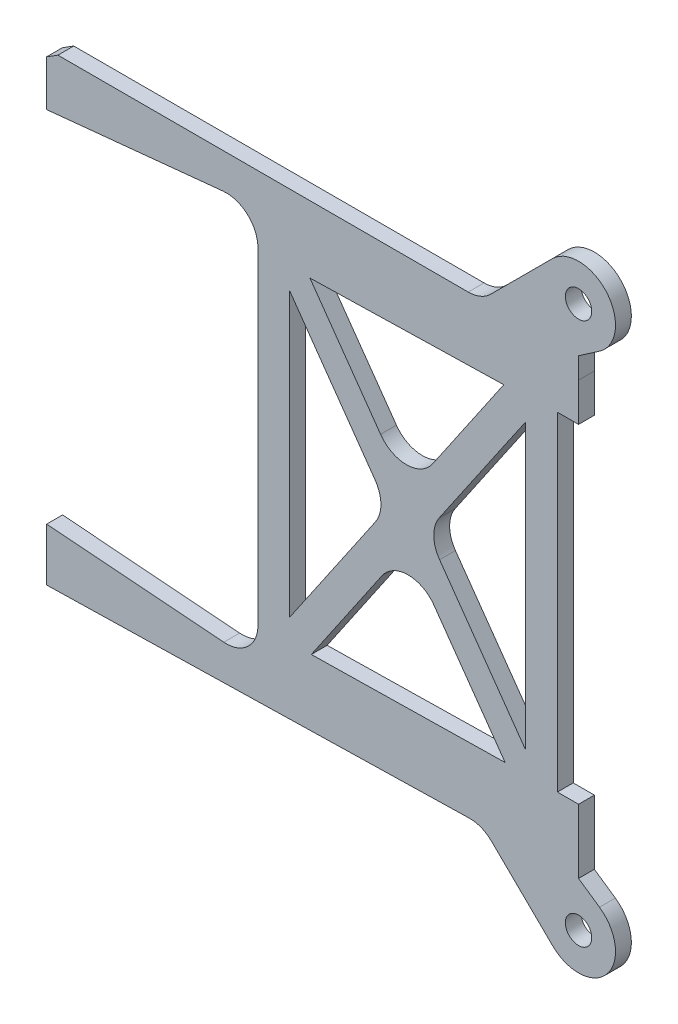
from build123d import *

# Parameters (mm, degrees)
MODEL_R         = 1.25
EXTRUDE_1_DEPTH = 1.5


with BuildPart() as part:
    # Model → 凸台-拉伸1 (new body)
    with BuildSketch(Plane.XY):
        with BuildLine():
            Line((580.995568625, 495.770292788), (600.902512418, 495.770292788))
            ThreePointArc((600.902512418, 495.770292788), (602.050562715, 495.99865419), (603.023832761, 496.648972444))
            Line((603.023832761, 496.648972444), (608.87002472, 502.495166354))
            ThreePointArc((608.87002472, 502.495166354), (614.034668548, 502.25974311), (613.330350777, 497.137936158))
            Line((613.330350777, 497.137936158), (611.344894179, 495.770295165))
            Line((611.344894179, 495.770295165), (611.344903066, 493.770295165))
            Line((611.344903066, 493.770295165), (611.344898622, 490.139940091))
            Line((611.344898622, 490.139940091), (609.344898622, 490.139940091))
            Line((609.344898622, 490.139940091), (609.344898622, 459.003527023))
            Line((609.344898622, 459.003527023), (611.344898622, 459.003527023))
            Line((611.344898622, 459.003527023), (611.344903066, 454.922529401))
            Line((611.344903066, 454.922529401), (611.344903066, 452.922529401))
            Line((611.344903066, 452.922529401), (613.330355459, 451.554880428))
            ThreePointArc((613.330355459, 451.554880428), (614.034666789, 446.433074588), (608.870024851, 446.197653326))
            Line((608.870024851, 446.197653326), (607.649614702, 447.394418416))
            Line((607.649614702, 447.394418416), (603.130826548, 451.825656479))
            ThreePointArc((603.130826548, 451.825656479), (602.127647934, 452.488182187), (600.942551931, 452.690308661))
            Line((600.942551931, 452.690308661), (580.995568625, 452.245019157))
            Line((580.995568625, 452.245019157), (561.000550217, 451.798657335))
            Line((561.000550217, 451.798657335), (561.000550217, 456.798657335))
            Line((561.000550217, 456.798657335), (577.763165347, 455.496180974))
            ThreePointArc((577.763165347, 455.496180974), (580.033065884, 456.285210752), (580.995568625, 458.487165547))
            Line((580.995568625, 458.487165547), (580.995568625, 489.455330101))
            ThreePointArc((580.995568625, 489.455330101), (580.008584587, 491.679687702), (577.697057468, 492.440441672))
            Line((577.697057468, 492.440441672), (560.995568625, 490.770292788))
            Line((560.995568625, 490.770292788), (560.995568625, 495.100850038))
            Line((560.995568625, 495.100850038), (562.062443854, 495.770292788))
            Line((562.062443854, 495.770292788), (580.995568625, 495.770292788))
        make_face()
        with Locations((611.344898622, 500.020292788)):
            Circle(MODEL_R, mode=Mode.SUBTRACT)
        with Locations((611.344898622, 448.672527023)):
            Circle(MODEL_R, mode=Mode.SUBTRACT)
        with BuildLine():
            Line((585.91647506, 489.426366255), (604.267397119, 489.857372067))
            Line((604.267397119, 489.857372067), (597.532531309, 479.99996659))
            ThreePointArc((597.532531309, 479.99996659), (595.079201685, 478.692455827), (592.605499439, 479.961001386))
            Line((592.605499439, 479.961001386), (585.91647506, 489.426366255))
        make_face(mode=Mode.SUBTRACT)
        with BuildLine():
            Line((586.047448792, 458.632826912), (604.397047311, 458.951765009))
            Line((604.397047311, 458.951765009), (597.664323818, 468.47211859))
            ThreePointArc((597.664323818, 468.47211859), (595.190191772, 469.739825644), (592.737305457, 468.431483456))
            Line((592.737305457, 468.431483456), (586.047448792, 458.632826912))
        make_face(mode=Mode.SUBTRACT)
        with BuildLine():
            Line((583.99514789, 460.649796595), (583.995526777, 487.427452126))
            Line((583.995526777, 487.427452126), (592.089795546, 475.957499013))
            ThreePointArc((592.089795546, 475.957499013), (592.638587507, 474.250490234), (592.115726369, 472.535361137))
            Line((592.115726369, 472.535361137), (583.99514789, 460.649796595))
        make_face(mode=Mode.SUBTRACT)
        with BuildLine():
            Line((606.345062591, 460.933766521), (606.346502303, 487.858246923))
            Line((606.346502303, 487.858246923), (598.164147844, 475.898832518))
            ThreePointArc((598.164147844, 475.898832518), (597.640194793, 474.182081738), (598.190130861, 472.473476938))
            Line((598.190130861, 472.473476938), (606.345062591, 460.933766521))
        make_face(mode=Mode.SUBTRACT)
    extrude(amount=EXTRUDE_1_DEPTH)


solid = part.part
